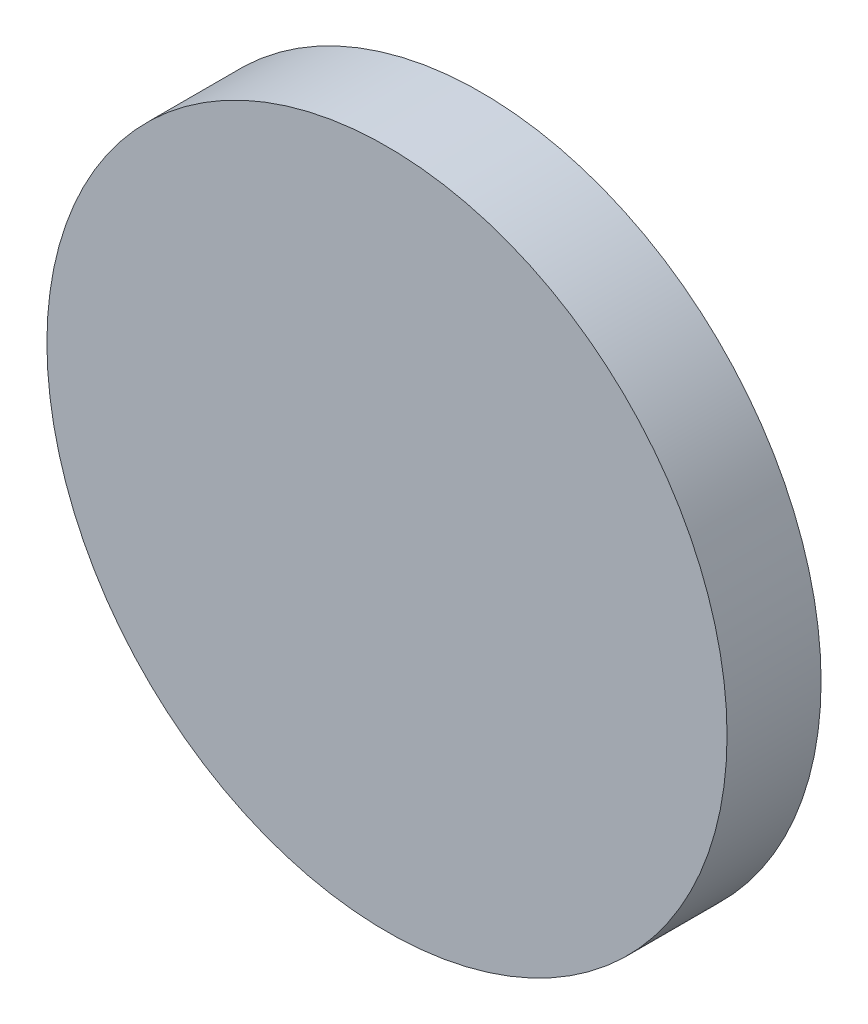
from build123d import *

# Parameters (mm, degrees)
SKETCH1_R           = 10.85
BOSS_EXTRUDE1_DEPTH = 3


with BuildPart() as part:
    # Sketch1 → Boss-Extrude1 (new body)
    with BuildSketch(Plane.XY):
        Circle(SKETCH1_R)
    extrude(amount=BOSS_EXTRUDE1_DEPTH)


solid = part.part
